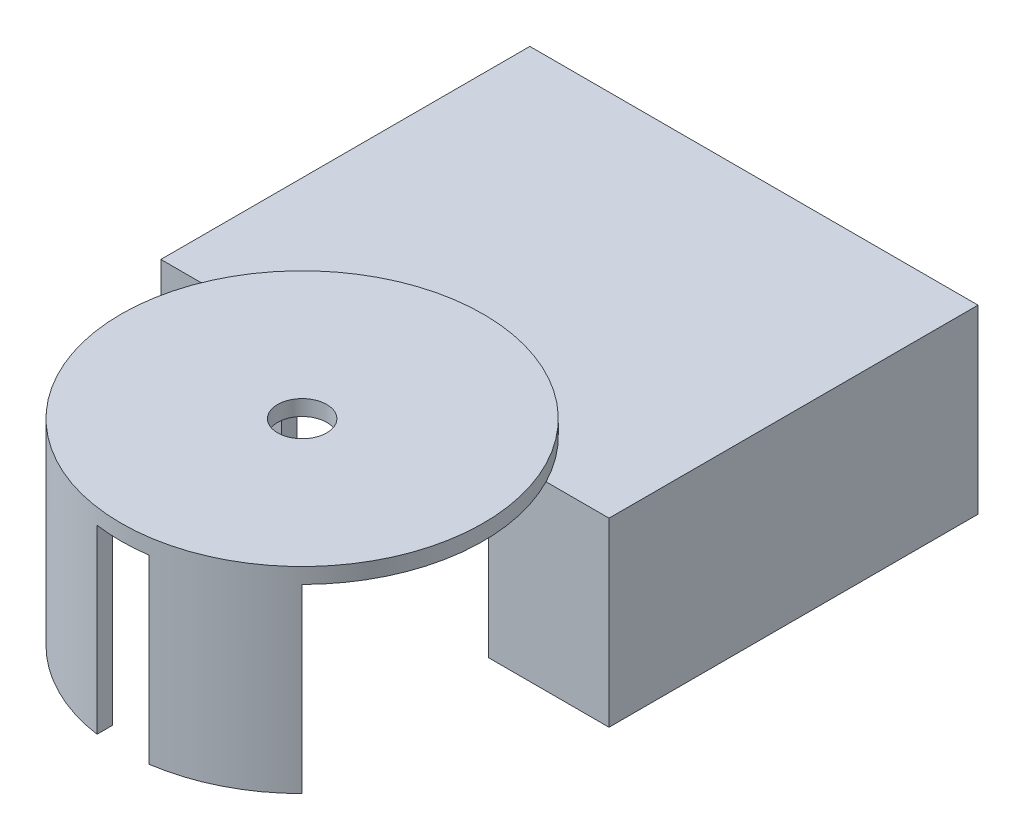
from build123d import *
from build123d.topology import SkipClean

# Parameters (mm, degrees)
CROQUIS1_R                        = 35
CROQUIS1_R_2                      = 4.75
SALIENTE_EXTRUIR1_DEPTH           = 3
CROQUIS2_R                        = 1.95
SALIENTE_EXTRUIR2_DEPTH           = 5
SALIENTE_EXTRUIR3_START           = 1
CROQUIS5_R                        = 2.25
SALIENTE_EXTRUIR3_DEPTH           = 4
SALIENTE_EXTRUIR3_DRAFT           = 4
SALIENTE_EXTRUIR3_PROFILE_2_DEPTH = 4
SALIENTE_EXTRUIR3_PROFILE_2_DRAFT = 4
CROQUIS3_W                        = 1
CROQUIS3_H                        = 6.840682912
CORTAR_EXTRUIR1_DEPTH             = 4
CROQUIS6_W                        = 5.727241663
CROQUIS6_H                        = 1.622786798
CROQUIS6_W_2                      = 5.017003251
CROQUIS6_H_2                      = 0.546869116
CROQUIS6_W_3                      = 4.668475527
CROQUIS6_H_3                      = 1.179349449
CROQUIS6_W_4                      = 4.588943699
CROQUIS6_H_4                      = 1.521824685
CORTAR_EXTRUIR2_DEPTH             = 4
SALIENTE_EXTRUIR4_START           = 35
SALIENTE_EXTRUIR4_DEPTH           = 35
CROQUIS9_W                        = 86.6
CROQUIS9_H                        = 71.3
SALIENTE_EXTRUIR5_DEPTH           = 3
CROQUIS10_W                       = 86.6
CROQUIS10_H                       = 71.3
CROQUIS10_W_2                     = 80.6
CROQUIS10_H_2                     = 65.3
SALIENTE_EXTRUIR6_DEPTH           = 32
CORTAR_EXTRUIR3_REACH             = 106.595
CROQUIS11_W                       = 40
CROQUIS11_H                       = 3
CROQUIS12_R                       = 2.5
CROQUIS12_R_2                     = 1.59
SALIENTE_EXTRUIR7_DEPTH           = 5
CROQUIS13_W                       = 14
CROQUIS13_H                       = 14
CROQUIS13_W_2                     = 11
CROQUIS13_H_2                     = 11
CORTAR_EXTRUIR4_DEPTH             = 3


with BuildPart() as part:
    # Croquis1 → Saliente-Extruir1 (new body)
    with BuildSketch(Plane(origin=(0, 0, 0), x_dir=(1, 0, 0), z_dir=(0, 1, 0))):
        with Locations(Location((0, 0, 0), (0, 0, 270))):
            Circle(CROQUIS1_R)
        with Locations(Location((0, 0, 0), (0, 0, 270))):
            Circle(CROQUIS1_R_2, mode=Mode.SUBTRACT)
    extrude(amount=SALIENTE_EXTRUIR1_DEPTH)

    # Croquis2 → Saliente-Extruir2 (add)
    with BuildSketch(Plane.XZ):
        with Locations(Location((-17.5, 8, 0), (0, 0, 90))):
            Circle(CROQUIS2_R)
        with Locations(Location((17.5, 8, 0), (0, 0, 90))):
            Circle(CROQUIS2_R)
    extrude(amount=SALIENTE_EXTRUIR2_DEPTH)


with BuildPart() as saliente_extruir3_tool:
    # Croquis5 → Saliente-Extruir3 (with draft: the straight prism first)
    with BuildSketch(Plane.XZ.offset(SALIENTE_EXTRUIR3_START)):
        with Locations((-17.5, 8)):
            Circle(CROQUIS5_R)
    extrude(amount=SALIENTE_EXTRUIR3_DEPTH)
    # Saliente-Extruir3: the draft: its side faces are tilted about the plane it starts from
    saliente_extruir3_sides = [saliente_extruir3_tool.faces().sort_by_distance(p)[0] for p in [
        (-19.75, -3, 8),
    ]]
    draft(saliente_extruir3_sides, Plane.XZ.offset(SALIENTE_EXTRUIR3_START), SALIENTE_EXTRUIR3_DRAFT)


with BuildPart() as part_1:
    add(part.part)

    # Saliente-Extruir3: add saliente_extruir3_tool
    add(saliente_extruir3_tool.part)


with BuildPart() as saliente_extruir3_profile_2_tool:
    # Croquis5 → Saliente-Extruir3 profile 2 (with draft: the straight prism first)
    with BuildSketch(Plane.XZ.offset(SALIENTE_EXTRUIR3_START)):
        with Locations((17.5, 8)):
            Circle(CROQUIS5_R)
    extrude(amount=SALIENTE_EXTRUIR3_PROFILE_2_DEPTH)
    # Saliente-Extruir3 profile 2: the draft: its side faces are tilted about the plane it starts from
    saliente_extruir3_profile_2_sides = [saliente_extruir3_profile_2_tool.faces().sort_by_distance(p)[0] for p in [
        (15.25, -3, 8),
    ]]
    draft(saliente_extruir3_profile_2_sides, Plane.XZ.offset(SALIENTE_EXTRUIR3_START), SALIENTE_EXTRUIR3_PROFILE_2_DRAFT)


with BuildPart() as part_2:
    add(part_1.part)

    # Saliente-Extruir3 profile 2: add saliente_extruir3_profile_2_tool
    add(saliente_extruir3_profile_2_tool.part)

    # Croquis3 → Cortar-Extruir1 (cut)
    with BuildSketch(Plane.XZ.offset(5)):
        with Locations((-17.5, 7.675365729)):
            Rectangle(CROQUIS3_W, CROQUIS3_H)
        with Locations((17.5, 7.675365729)):
            Rectangle(CROQUIS3_W, CROQUIS3_H)
    extrude(amount=-CORTAR_EXTRUIR1_DEPTH, mode=Mode.SUBTRACT)

    # Croquis6 → Cortar-Extruir2 (cut)
    with BuildSketch(Plane.XZ.offset(1)):
        with Locations((-17.258839661, 10.696201081)):
            Rectangle(CROQUIS6_W, CROQUIS6_H)
        with Locations((-17.417509945, 5.84175776)):
            Rectangle(CROQUIS6_W_2, CROQUIS6_H_2)
        with Locations((17.632507556, 10.474482406)):
            Rectangle(CROQUIS6_W_3, CROQUIS6_H_3)
        with Locations((17.310781188, 5.354279976)):
            Rectangle(CROQUIS6_W_4, CROQUIS6_H_4)
    extrude(amount=CORTAR_EXTRUIR2_DEPTH, mode=Mode.SUBTRACT)

    # Croquis7 → Saliente-Extruir4 (add)
    with SkipClean():  # the faces are left unmerged after this step: merging them gives an invalid solid
        with BuildSketch(Plane.XZ.offset(SALIENTE_EXTRUIR4_START)):
            with BuildLine():
                Line((-22.651194874, 22.651194874), (-24.748737342, 24.748737342))
                ThreePointArc((-24.748737342, 24.748737342), (-15.674335611, 31.294012257), (-4.998139738, 34.641284606))
                Line((-4.998139738, 34.641284606), (-4.998139738, 31.641284606))
                ThreePointArc((-4.998139738, 31.641284606), (-14.537086186, 28.545154562), (-22.651194874, 22.651194874))
            make_face()
            with BuildLine():
                Line((22.651200534, 22.651200534), (24.748737342, 24.748737342))
                ThreePointArc((24.748737342, 24.748737342), (15.675128347, 31.293615184), (4.999894801, 34.641031335))
                Line((4.999894801, 34.641031335), (4.999894801, 31.641031335))
                ThreePointArc((4.999894801, 31.641031335), (14.537881979, 28.544766366), (22.651200534, 22.651200534))
            make_face()
        extrude(amount=-SALIENTE_EXTRUIR4_DEPTH)

    # Croquis9 → Saliente-Extruir5 (add)
    with SkipClean():  # the faces are left unmerged after this step: merging them gives an invalid solid
        with BuildSketch(Plane.XZ):
            with Locations((0, -51.65)):
                Rectangle(CROQUIS9_W, CROQUIS9_H)
        extrude(amount=SALIENTE_EXTRUIR5_DEPTH)

    # Croquis10 → Saliente-Extruir6 (add)
    with SkipClean():  # the faces are left unmerged after this step: merging them gives an invalid solid
        with BuildSketch(Plane.XZ.offset(3)):
            with Locations((0, -51.65)):
                Rectangle(CROQUIS10_W, CROQUIS10_H)
            with Locations((0, -51.65)):
                Rectangle(CROQUIS10_W_2, CROQUIS10_H_2, mode=Mode.SUBTRACT)
        extrude(amount=SALIENTE_EXTRUIR6_DEPTH)

    # Cortar-Extruir3: up to this face of the body (flat: up to its plane)
    cortar_extruir3_end = Plane(part_2.part.faces().sort_by_distance((1.0887e-05, 0, 5.820345138))[0])
    # Croquis11 → Cortar-Extruir3 (cut, up to the picked face)
    with BuildSketch(Plane.XZ.offset(35), mode=Mode.PRIVATE) as cortar_extruir3_sk1:
        with Locations((0, -17.5)):
            Rectangle(CROQUIS11_W, CROQUIS11_H)
    cortar_extruir3_tool1 = split(extrude(cortar_extruir3_sk1.sketch, amount=-CORTAR_EXTRUIR3_REACH, mode=Mode.PRIVATE), bisect_by=cortar_extruir3_end, keep=Keep.BOTH, mode=Mode.PRIVATE)
    add(cortar_extruir3_tool1.solids().sort_by(Axis((0, -35, -17.5), (0, 1, 0)))[0], mode=Mode.SUBTRACT)

    # Croquis12 → Saliente-Extruir7 (add)
    # profile 1 of 4: a face of its own
    with SkipClean():  # the faces are left unmerged after this step: merging them gives an invalid solid
        with BuildSketch(Plane.XZ.offset(3)):
            with Locations(Location((31.8, -42.7, 0), (0, 0, 270))):
                Circle(CROQUIS12_R)
            with Locations(Location((31.8, -42.7, 0), (0, 0, 270))):
                Circle(CROQUIS12_R_2, mode=Mode.SUBTRACT)
        # profile 2 of 4: a face of its own
        with BuildSketch(Plane.XZ.offset(3)):
            with Locations(Location((31.8, -70.6, 0), (0, 0, 270))):
                Circle(CROQUIS12_R)
            with Locations(Location((31.8, -70.6, 0), (0, 0, 270))):
                Circle(CROQUIS12_R_2, mode=Mode.SUBTRACT)
        # profile 3 of 4: a face of its own
        with BuildSketch(Plane.XZ.offset(3)):
            with Locations(Location((-19, -27.5, 0), (0, 0, 270))):
                Circle(CROQUIS12_R)
            with Locations(Location((-19, -27.5, 0), (0, 0, 270))):
                Circle(CROQUIS12_R_2, mode=Mode.SUBTRACT)
        # profile 4 of 4: a face of its own
        with BuildSketch(Plane.XZ.offset(3)):
            with Locations(Location((-20.1, -75.3, 0), (0, 0, 270))):
                Circle(CROQUIS12_R)
            with Locations(Location((-20.1, -75.3, 0), (0, 0, 270))):
                Circle(CROQUIS12_R_2, mode=Mode.SUBTRACT)
        extrude(amount=SALIENTE_EXTRUIR7_DEPTH)

    # Croquis13 → Cortar-Extruir4 (cut)
    with SkipClean():  # the faces are left unmerged after this step: merging them gives an invalid solid
        with BuildSketch(Plane(origin=(-40.3, 0, 0), x_dir=(0, 0, -1), z_dir=(1, 0, 0))):
            with Locations((40.6, -15)):
                Rectangle(CROQUIS13_W, CROQUIS13_H)
            with Locations((70.8, -13.5)):
                Rectangle(CROQUIS13_W_2, CROQUIS13_H_2)
        extrude(amount=-CORTAR_EXTRUIR4_DEPTH, mode=Mode.SUBTRACT)


solid = part_2.part
